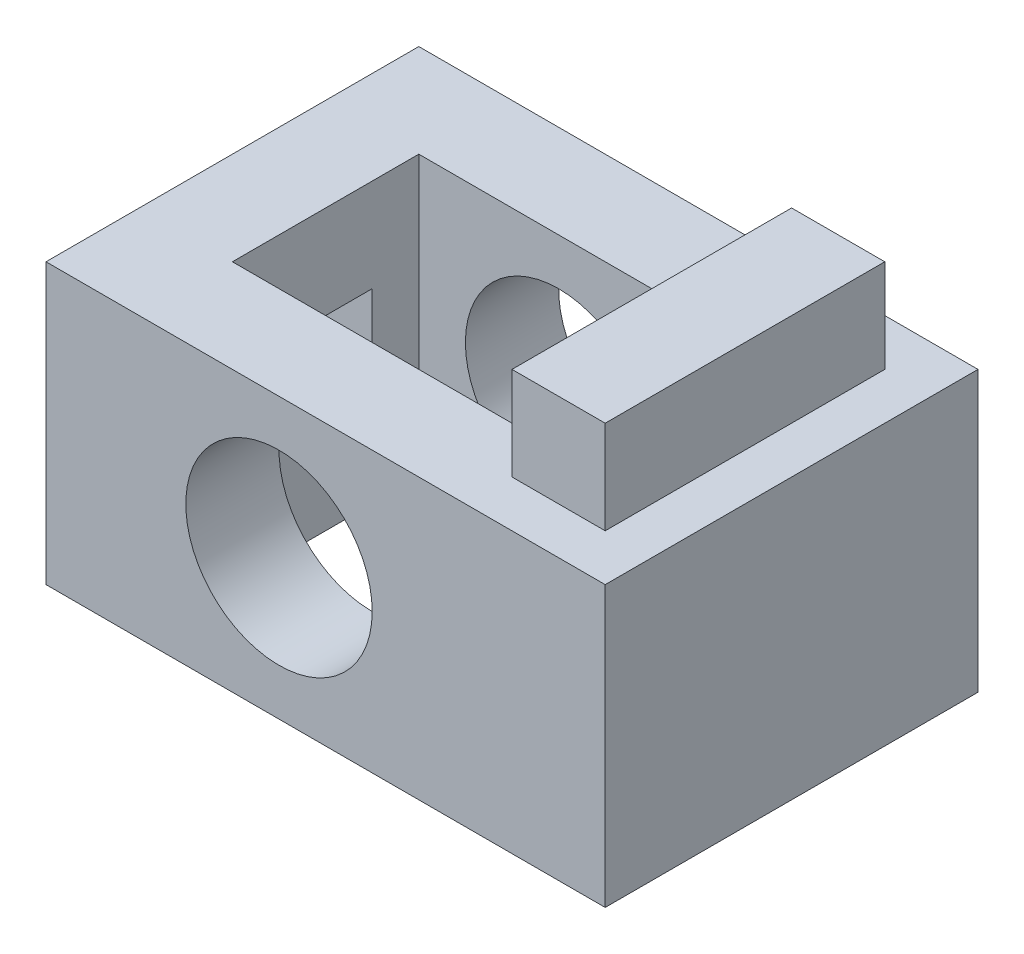
from build123d import *

# Parameters (mm, degrees)
SKETCH2_W           = 203.2
SKETCH2_H           = 152.4
BOSS_EXTRUDE1_DEPTH = 152.4
SKETCH6_R           = 50.8
CUT_EXTRUDE2_DEPTH  = 228.6
SKETCH7_W           = 50.8
SKETCH7_H           = 50.8
CUT_EXTRUDE3_DEPTH  = 50.8
SKETCH5_W           = 50.8
SKETCH5_H           = 152.4
BOSS_EXTRUDE3_DEPTH = 50.8
SKETCH3_W           = 152.4
SKETCH3_H           = 101.6
CUT_EXTRUDE4_DEPTH  = 228.6


with BuildPart() as part:
    # Sketch2 → Boss-Extrude1 (new, symmetric)
    with BuildSketch(Plane(origin=(0, 0, 0), x_dir=(0, 0, -1), z_dir=(1, 0, 0))):
        Rectangle(SKETCH2_W, SKETCH2_H)
    extrude(amount=BOSS_EXTRUDE1_DEPTH, both=True)

    # Sketch6 → Cut-Extrude2 (cut)
    with BuildSketch(Plane.XY.offset(101.6)):
        with Locations((-25.4, 0)):
            Circle(SKETCH6_R)
    extrude(amount=-CUT_EXTRUDE2_DEPTH, mode=Mode.SUBTRACT)

    # Sketch7 → Cut-Extrude3 (cut)
    with BuildSketch(Plane.ZY.offset(152.4)):
        Rectangle(SKETCH7_W, SKETCH7_H)
    extrude(amount=-CUT_EXTRUDE3_DEPTH, mode=Mode.SUBTRACT)

    # Sketch5 → Boss-Extrude3 (add)
    with BuildSketch(Plane(origin=(0, 76.2, 0), x_dir=(1, 0, 0), z_dir=(0, 1, 0))):
        with Locations((101.6, 0)):
            Rectangle(SKETCH5_W, SKETCH5_H)
    extrude(amount=BOSS_EXTRUDE3_DEPTH)

    # Sketch3 → Cut-Extrude4 (cut)
    with BuildSketch(Plane(origin=(0, 76.2, 0), x_dir=(1, 0, 0), z_dir=(0, 1, 0))):
        with Locations((-25.4, 0)):
            Rectangle(SKETCH3_W, SKETCH3_H)
    extrude(amount=-CUT_EXTRUDE4_DEPTH, mode=Mode.SUBTRACT)


solid = part.part
